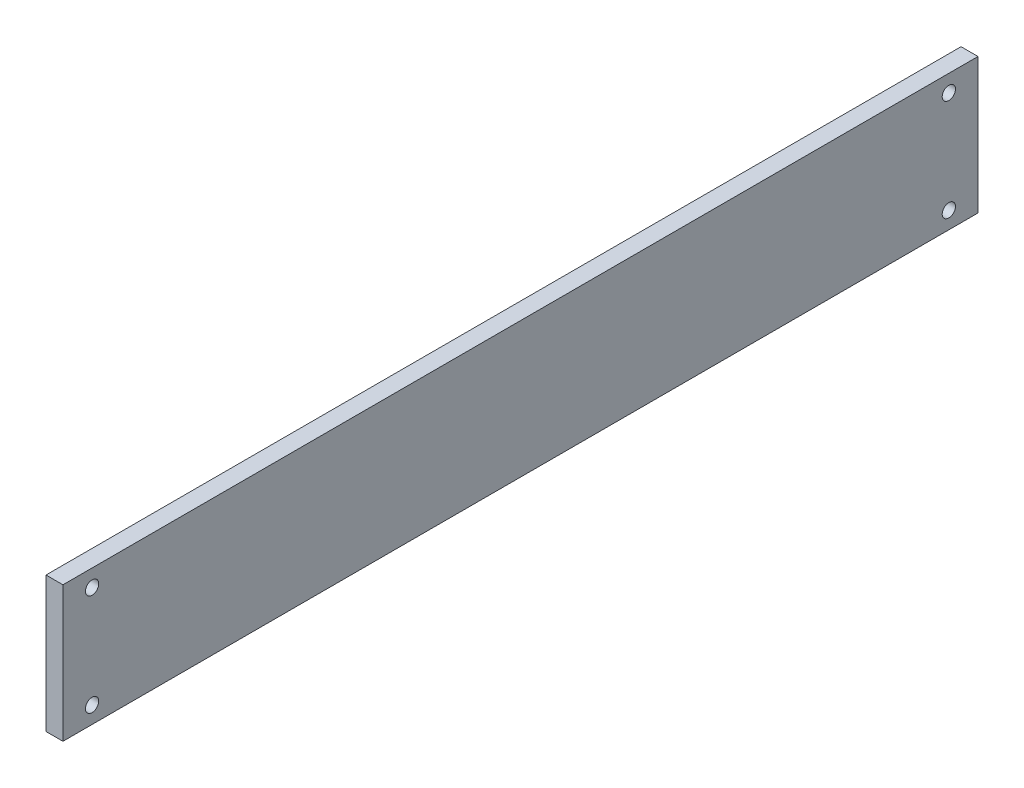
from build123d import *

# Parameters (mm, degrees)
SKETCH1_W           = 342.9
SKETCH1_H           = 50.8
SKETCH1_R           = 2.4892
BOSS_EXTRUDE1_DEPTH = 6.35


with BuildPart() as part:
    # Sketch1 → Boss-Extrude1 (new body)
    with BuildSketch(Plane(origin=(0, 0, 0), x_dir=(0, 0, -1), z_dir=(1, 0, 0))):
        Rectangle(SKETCH1_W, SKETCH1_H)
        with Locations((-160.528, 19.05)):
            Circle(SKETCH1_R, mode=Mode.SUBTRACT)
        with Locations((-160.528, -19.05)):
            Circle(SKETCH1_R, mode=Mode.SUBTRACT)
        with Locations((160.528, -19.05)):
            Circle(SKETCH1_R, mode=Mode.SUBTRACT)
        with Locations((160.528, 19.05)):
            Circle(SKETCH1_R, mode=Mode.SUBTRACT)
    extrude(amount=BOSS_EXTRUDE1_DEPTH)


solid = part.part
